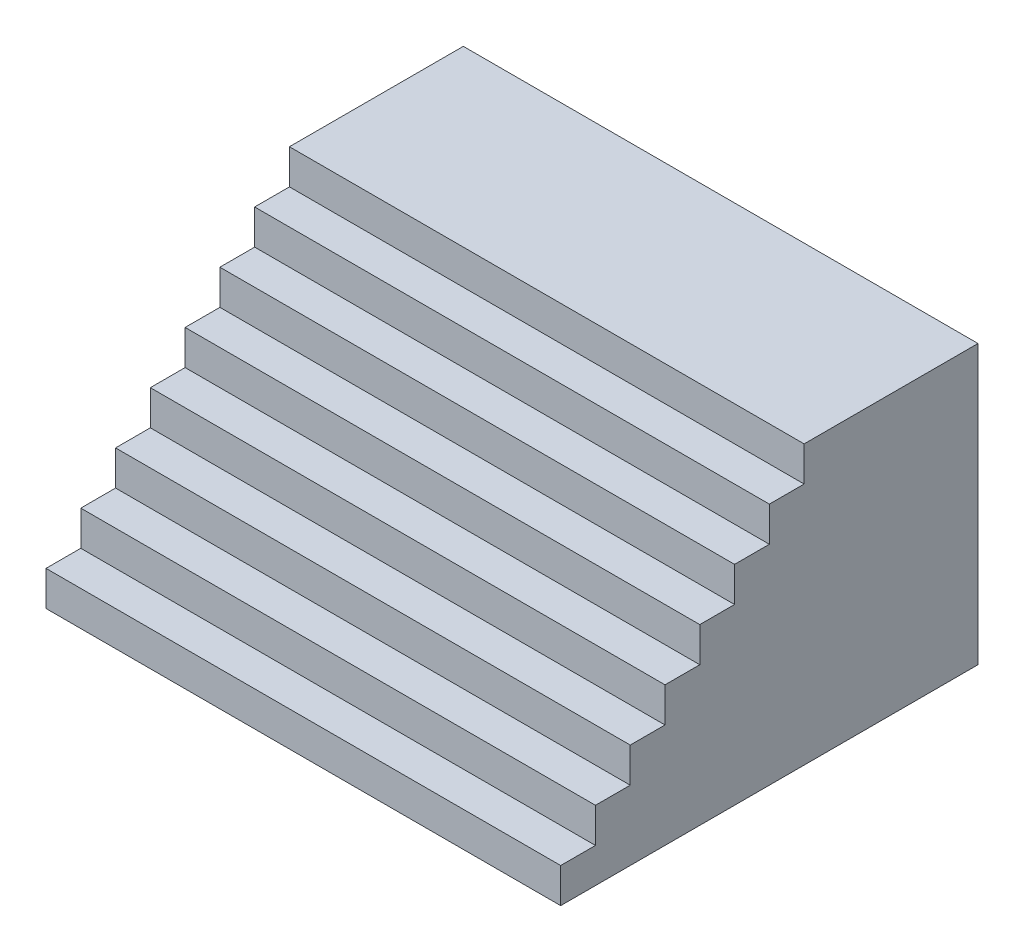
from build123d import *

# Parameters (mm, degrees)
BOSS_EXTRUDE2_DEPTH = 3000
CUT_EXTRUDE1_DEPTH  = 4000


with BuildPart() as part:
    # 3DSketch3 → Boss-Extrude2 (new body)
    with BuildSketch(Plane(origin=(-1850, 1000, 0), x_dir=(0.8797065135761271, -0.47551703436547405, 0), z_dir=(0, 0, 1))):
        Polygon((0, 0), (3254.914100232, 1759.413027152), (4205.948168963, 0), (951.034068731, -1759.413027152), align=None)
    extrude(amount=BOSS_EXTRUDE2_DEPTH)

    # Sketch4 → Cut-Extrude1 (cut)
    with BuildSketch(Plane.ZY.offset(1850)):
        Polygon((3000, -750), (2750, -750), (2750, -500), (2500, -500), (2500, -250), (2250, -250), (2250, 0), (2000, 0), (2000, 250), (1750, 250), (1750, 500), (1500, 500), (1500, 750), (1250, 750), (1250, 1000), (3000, 1000), align=None)
    extrude(amount=-CUT_EXTRUDE1_DEPTH, mode=Mode.SUBTRACT)


solid = part.part
